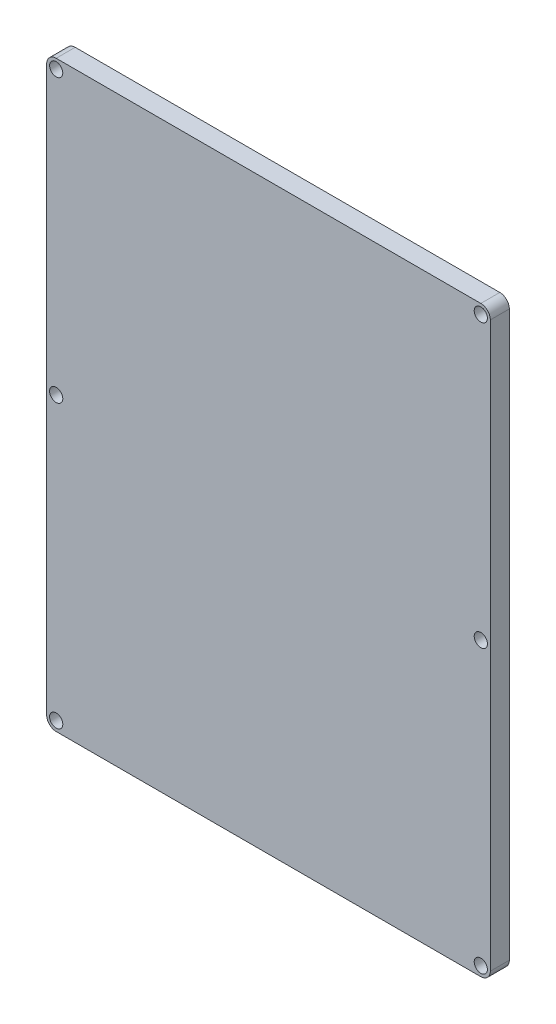
from build123d import *

# Parameters (mm, degrees)
BOSS_EXTRUDE1_DEPTH       = 3
TAP_DRILL_FOR_3_56_TAP1_D = 2.0828
CUT_EXTRUDE1_DEPTH        = 0.1


with BuildPart() as part:
    # Sketch1 → Boss-Extrude1 (new body)
    with BuildSketch(Plane.XY):
        with BuildLine():
            Line((-33.5, 46), (33.5, 46))
            ThreePointArc((33.5, 46), (34.560660172, 45.560660172), (35, 44.5))
            Line((35, 44.5), (35, -44.5))
            ThreePointArc((35, -44.5), (34.560660172, -45.560660172), (33.5, -46))
            Line((33.5, -46), (-33.5, -46))
            ThreePointArc((-33.5, -46), (-34.560660172, -45.560660172), (-35, -44.5))
            Line((-35, -44.5), (-35, 44.5))
            ThreePointArc((-35, 44.5), (-34.560660172, 45.560660172), (-33.5, 46))
        make_face()
    extrude(amount=BOSS_EXTRUDE1_DEPTH)

    # Tap Drill for #3-56 Tap1 (through all)
    with Locations(Plane(origin=(0, 0, 0), x_dir=(-1, 0, 0), z_dir=(0, 0, -1))):
        with Locations((-33.5, 44.5), (33.5, -44.5), (33.5, 0), (-33.5, 0), (-33.5, -44.5), (33.5, 44.5)):
            Hole(TAP_DRILL_FOR_3_56_TAP1_D / 2)

    # Sketch7 → Cut-Extrude1 (cut)
    with BuildSketch(Plane(origin=(0, 0, 0), x_dir=(-1, 0, 0), z_dir=(0, 0, -1))):
        with BuildLine():
            Line((26, 44), (-28, 44))
            ThreePointArc((-28, 44), (-28.707106781, 43.707106781), (-29, 43))
            Line((-29, 43), (-29, -45))
            ThreePointArc((-29, -45), (-28.707106781, -45.707106781), (-28, -46))
            Line((-28, -46), (26, -46))
            ThreePointArc((26, -46), (26.707106781, -45.707106781), (27, -45))
            Line((27, -45), (27, 43))
            ThreePointArc((27, 43), (26.707106781, 43.707106781), (26, 44))
        make_face()
    extrude(amount=-CUT_EXTRUDE1_DEPTH, mode=Mode.SUBTRACT)


solid = part.part
